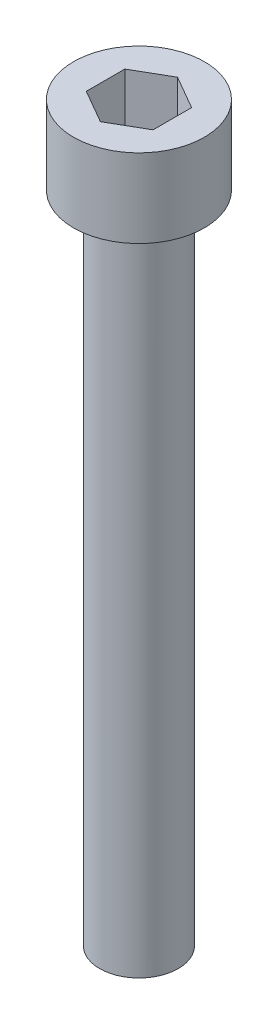
from build123d import *

# Parameters (mm, degrees)
SKETCH_1_R      = 5
EXTRUDE_1_DEPTH = 6
SKETCH_2_R      = 3
EXTRUDE_2_DEPTH = 50


with BuildPart() as part:
    # Эскиз1 → Вытянуть1 (new body)
    with BuildSketch(Plane(origin=(0, 0, 0), x_dir=(1, 0, 0), z_dir=(0, 1, 0))):
        with Locations(Location((0, 0, 0), (0, 0, 270))):
            Circle(SKETCH_1_R)
        Polygon((0, -2.944486373), (2.55, -1.472243186), (2.55, 1.472243186), (0, 2.944486373), (-2.55, 1.472243186), (-2.55, -1.472243186), align=None, mode=Mode.SUBTRACT)
    extrude(amount=EXTRUDE_1_DEPTH)

    # Эскиз2 → Вытянуть2 (add)
    with BuildSketch(Plane.XZ):
        with Locations(Location((0, 0, 0), (0, 0, 90))):
            Circle(SKETCH_2_R)
    extrude(amount=EXTRUDE_2_DEPTH)


solid = part.part
